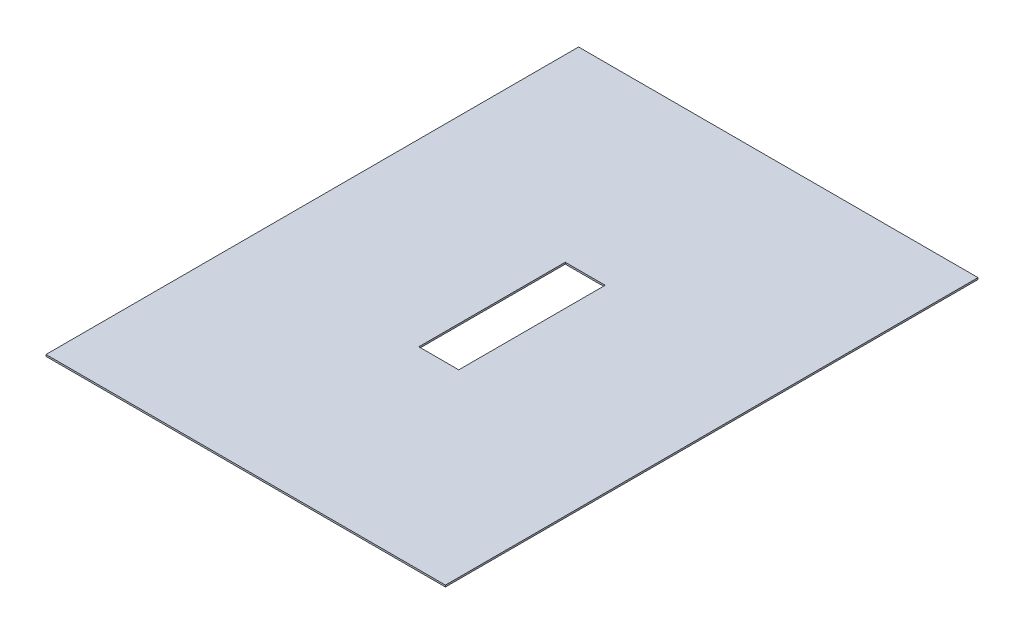
from build123d import *

# Parameters (mm, degrees)
SKETCH1_W           = 30
SKETCH1_H           = 40
SKETCH1_W_2         = 3
SKETCH1_H_2         = 11
BOSS_EXTRUDE1_DEPTH = 0.127


with BuildPart() as part:
    # Sketch1 → Boss-Extrude1 (new body)
    with BuildSketch(Plane(origin=(0, 0, 0), x_dir=(1, 0, 0), z_dir=(0, 1, 0))):
        with Locations((-0.976799909, 0.321714502)):
            Rectangle(SKETCH1_W, SKETCH1_H)
        with Locations((-0.976799909, 0.321714502)):
            Rectangle(SKETCH1_W_2, SKETCH1_H_2, mode=Mode.SUBTRACT)
    extrude(amount=BOSS_EXTRUDE1_DEPTH)


solid = part.part
